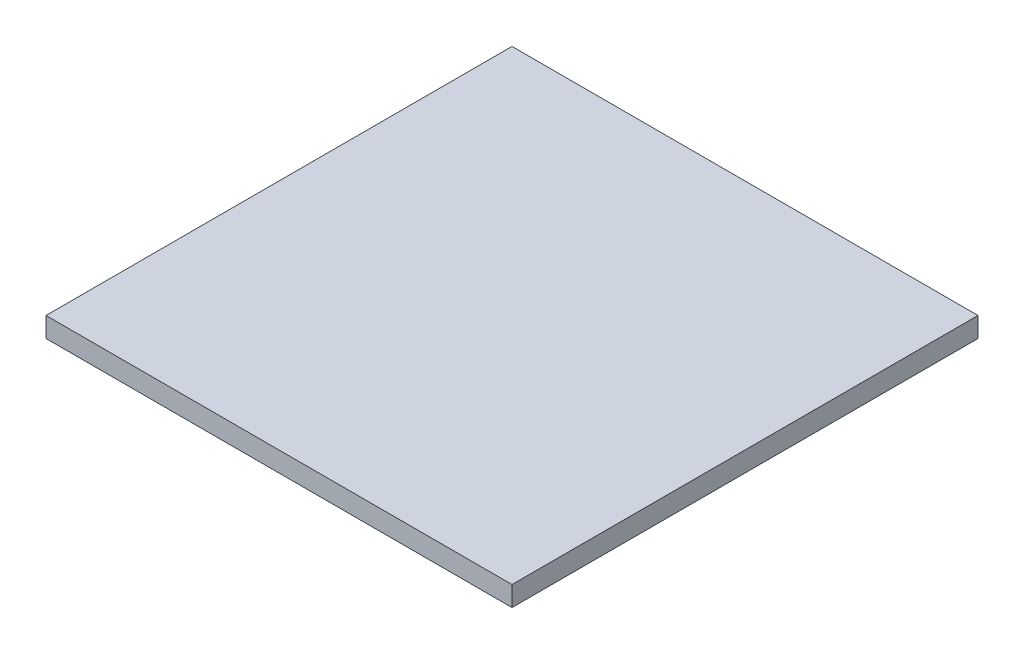
from build123d import *

# Parameters (mm, degrees)
SKETCH1_W           = 711.2
SKETCH1_H           = 711.2
BOSS_EXTRUDE1_DEPTH = 30.48


with BuildPart() as part:
    # Sketch1 → Boss-Extrude1 (new body)
    with BuildSketch(Plane(origin=(0, 0, 0), x_dir=(1, 0, 0), z_dir=(0, 1, 0))):
        with Locations((355.6, -355.6)):
            Rectangle(SKETCH1_W, SKETCH1_H)
    extrude(amount=BOSS_EXTRUDE1_DEPTH)


solid = part.part
